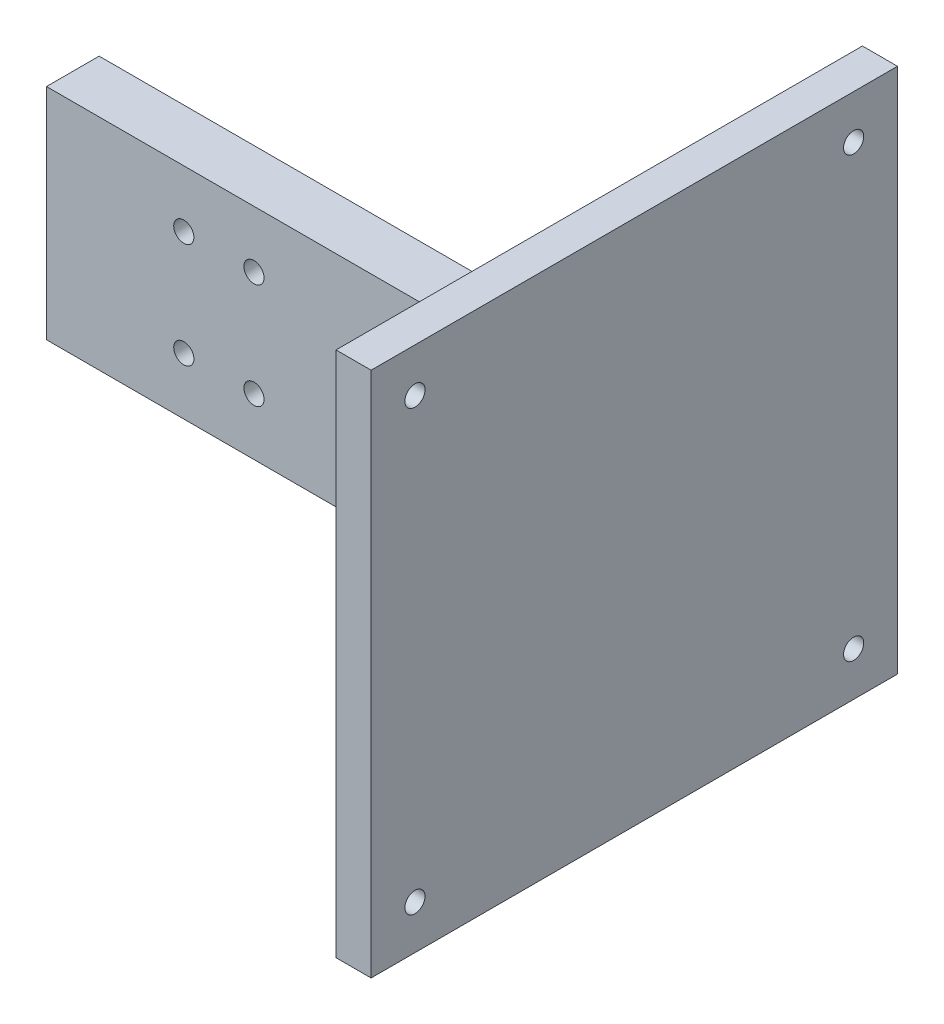
from build123d import *

# Parameters (mm, degrees)
SKETCH1_W           = 60
SKETCH1_H           = 25
BOSS_EXTRUDE1_DEPTH = 6
CUT_EXTRUDE3_DEPTH  = 3
SKETCH5_R           = 1.15
CUT_EXTRUDE4_DEPTH  = 33.638167841
SKETCH7_W           = 60
SKETCH7_H           = 60
BOSS_EXTRUDE2_DEPTH = 4
SKETCH8_R           = 1.15
CUT_EXTRUDE5_DEPTH  = 10
CUT_EXTRUDE6_START  = -2
SKETCH9_R           = 1.15
CUT_EXTRUDE6_DEPTH  = 2


with BuildPart() as part:
    # Sketch1 → Boss-Extrude1 (new body)
    with BuildSketch(Plane.XY):
        Rectangle(SKETCH1_W, SKETCH1_H)
    extrude(amount=BOSS_EXTRUDE1_DEPTH)

    # Sketch4 → Cut-Extrude3 (cut)
    with BuildSketch(Plane(origin=(0, 0, 0), x_dir=(-1, 0, 0), z_dir=(0, 0, -1))):
        with BuildLine():
            ThreePointArc((8.45, 6), (4.86507576, 7.48492424), (6.35, 3.9))
            Line((6.35, 3.9), (6.35, 6))
            Line((6.35, 6), (8.45, 6))
        make_face()
        with BuildLine():
            Line((6.35, 6), (6.35, 3.9))
            ThreePointArc((6.35, 3.9), (7.83492424, 4.51507576), (8.45, 6))
            Line((8.45, 6), (6.35, 6))
        make_face()
        with BuildLine():
            ThreePointArc((12.25, 6), (12.86507576, 4.51507576), (14.35, 3.9))
            Line((14.35, 3.9), (14.35, 6))
            Line((14.35, 6), (12.25, 6))
        make_face()
        with BuildLine():
            Line((14.35, 6), (14.35, 3.9))
            ThreePointArc((14.35, 3.9), (15.83492424, 4.51507576), (16.45, 6))
            ThreePointArc((16.45, 6), (14.35, 8.1), (12.25, 6))
            Line((12.25, 6), (14.35, 6))
        make_face()
        with BuildLine():
            ThreePointArc((14.35, -3.9), (12.86507576, -4.51507576), (12.25, -6))
            Line((12.25, -6), (14.35, -6))
            Line((14.35, -6), (14.35, -3.9))
        make_face()
        with BuildLine():
            Line((14.35, -6), (12.25, -6))
            ThreePointArc((12.25, -6), (14.35, -8.1), (16.45, -6))
            ThreePointArc((16.45, -6), (15.83492424, -4.51507576), (14.35, -3.9))
            Line((14.35, -3.9), (14.35, -6))
        make_face()
        with BuildLine():
            Line((6.35, -3.9), (6.35, -6))
            Line((6.35, -6), (8.45, -6))
            ThreePointArc((8.45, -6), (7.83492424, -4.51507576), (6.35, -3.9))
        make_face()
        with BuildLine():
            Line((8.45, -6), (6.35, -6))
            Line((6.35, -6), (6.35, -3.9))
            ThreePointArc((6.35, -3.9), (4.86507576, -7.48492424), (8.45, -6))
        make_face()
    extrude(amount=-CUT_EXTRUDE3_DEPTH, mode=Mode.SUBTRACT)

    # Sketch5 → Cut-Extrude4 (cut, through all)
    with BuildSketch(Plane(origin=(0, 0, 3), x_dir=(-1, 0, 0), z_dir=(0, 0, -1))):
        with Locations((6.35, 6)):
            Circle(SKETCH5_R)
        with Locations((14.35, 6)):
            Circle(SKETCH5_R)
        with Locations((14.35, -6)):
            Circle(SKETCH5_R)
        with Locations((6.35, -6)):
            Circle(SKETCH5_R)
    extrude(amount=-CUT_EXTRUDE4_DEPTH, mode=Mode.SUBTRACT)

    # Sketch7 → Boss-Extrude2 (add)
    with BuildSketch(Plane(origin=(30, 0, 0), x_dir=(0, 0, -1), z_dir=(1, 0, 0))):
        with Locations((-3, 0)):
            Rectangle(SKETCH7_W, SKETCH7_H)
    extrude(amount=BOSS_EXTRUDE2_DEPTH)

    # Sketch8 → Cut-Extrude5 (cut)
    with BuildSketch(Plane(origin=(34, 0, 0), x_dir=(0, 0, -1), z_dir=(1, 0, 0))):
        with Locations(Location((-28, -25, 0), (0, 0, 90))):
            Circle(SKETCH8_R)
        with Locations(Location((-28, 25, 0), (0, 0, 90))):
            Circle(SKETCH8_R)
        with BuildLine():
            ThreePointArc((23.15, -25), (22.440085947, -23.937538538), (21.186827202, -24.186827202))
            Line((21.186827202, -24.186827202), (22.813172798, -25.813172798))
            ThreePointArc((22.813172798, -25.813172798), (23.062461462, -25.440085947), (23.15, -25))
        make_face()
        with BuildLine():
            Line((22.813172798, -25.813172798), (21.186827202, -24.186827202))
            ThreePointArc((21.186827202, -24.186827202), (21.186827202, -25.813172798), (22.813172798, -25.813172798))
        make_face()
        with Locations(Location((22, 25, 0), (0, 0, 90))):
            Circle(SKETCH8_R)
    extrude(amount=-CUT_EXTRUDE5_DEPTH, mode=Mode.SUBTRACT)

    # Sketch9 → Cut-Extrude6 (cut)
    # profile 1 of 6: a face of its own
    with BuildSketch(Plane.ZY.offset(-30).offset(CUT_EXTRUDE6_START)):
        Polygon((25.9, 26.212435565), (25.9, 23.787564435), (28, 22.575128869), (30.1, 23.787564435), (30.1, 26.212435565), (28, 27.424871131), align=None)
        with Locations(Location((28, 25, 0), (0, 0, 90))):
            Circle(SKETCH9_R, mode=Mode.SUBTRACT)
    # profile 2 of 6: a face of its own
    with BuildSketch(Plane.ZY.offset(-30).offset(CUT_EXTRUDE6_START)):
        with BuildLine():
            Line((28.813172798, -25.813172798), (29.537306696, -26.537306696))
            Line((29.537306696, -26.537306696), (30.1, -26.212435565))
            Line((30.1, -26.212435565), (30.1, -23.787564435))
            Line((30.1, -23.787564435), (28, -22.575128869))
            Line((28, -22.575128869), (26.462693304, -23.462693304))
            Line((26.462693304, -23.462693304), (27.186827202, -24.186827202))
            ThreePointArc((27.186827202, -24.186827202), (28.440085947, -23.937538538), (29.15, -25))
            ThreePointArc((29.15, -25), (29.062461462, -25.440085947), (28.813172798, -25.813172798))
        make_face()
    # profile 3 of 6: a face of its own
    with BuildSketch(Plane.ZY.offset(-30).offset(CUT_EXTRUDE6_START)):
        with BuildLine():
            Line((28, -27.424871131), (29.537306696, -26.537306696))
            Line((29.537306696, -26.537306696), (28.813172798, -25.813172798))
            ThreePointArc((28.813172798, -25.813172798), (27.186827202, -25.813172798), (27.186827202, -24.186827202))
            Line((27.186827202, -24.186827202), (26.462693304, -23.462693304))
            Line((26.462693304, -23.462693304), (25.9, -23.787564435))
            Line((25.9, -23.787564435), (25.9, -26.212435565))
            Line((25.9, -26.212435565), (28, -27.424871131))
        make_face()
    # profile 4 of 6: a face of its own
    with BuildSketch(Plane.ZY.offset(-30).offset(CUT_EXTRUDE6_START)):
        Polygon((-22, -22.575128869), (-24.1, -23.787564435), (-24.1, -26.212435565), (-22, -27.424871131), (-19.9, -26.212435565), (-19.9, -23.787564435), align=None)
        with Locations(Location((-22, -25, 0), (0, 0, 90))):
            Circle(SKETCH9_R, mode=Mode.SUBTRACT)
    # profile 5 of 6: a face of its own
    with BuildSketch(Plane.ZY.offset(-30).offset(CUT_EXTRUDE6_START)):
        with BuildLine():
            Line((-21.186827202, 24.186827202), (-20.462693304, 23.462693304))
            Line((-20.462693304, 23.462693304), (-19.9, 23.787564435))
            Line((-19.9, 23.787564435), (-19.9, 26.212435565))
            Line((-19.9, 26.212435565), (-22, 27.424871131))
            Line((-22, 27.424871131), (-23.537306696, 26.537306696))
            Line((-23.537306696, 26.537306696), (-22.813172798, 25.813172798))
            ThreePointArc((-22.813172798, 25.813172798), (-21.559914053, 26.062461462), (-20.85, 25))
            ThreePointArc((-20.85, 25), (-20.937538538, 24.559914053), (-21.186827202, 24.186827202))
        make_face()
    # profile 6 of 6: a face of its own
    with BuildSketch(Plane.ZY.offset(-30).offset(CUT_EXTRUDE6_START)):
        with BuildLine():
            Line((-22, 22.575128869), (-20.462693304, 23.462693304))
            Line((-20.462693304, 23.462693304), (-21.186827202, 24.186827202))
            ThreePointArc((-21.186827202, 24.186827202), (-22.813172798, 24.186827202), (-22.813172798, 25.813172798))
            Line((-22.813172798, 25.813172798), (-23.537306696, 26.537306696))
            Line((-23.537306696, 26.537306696), (-24.1, 26.212435565))
            Line((-24.1, 26.212435565), (-24.1, 23.787564435))
            Line((-24.1, 23.787564435), (-22, 22.575128869))
        make_face()
    extrude(amount=CUT_EXTRUDE6_DEPTH, mode=Mode.SUBTRACT)


solid = part.part
